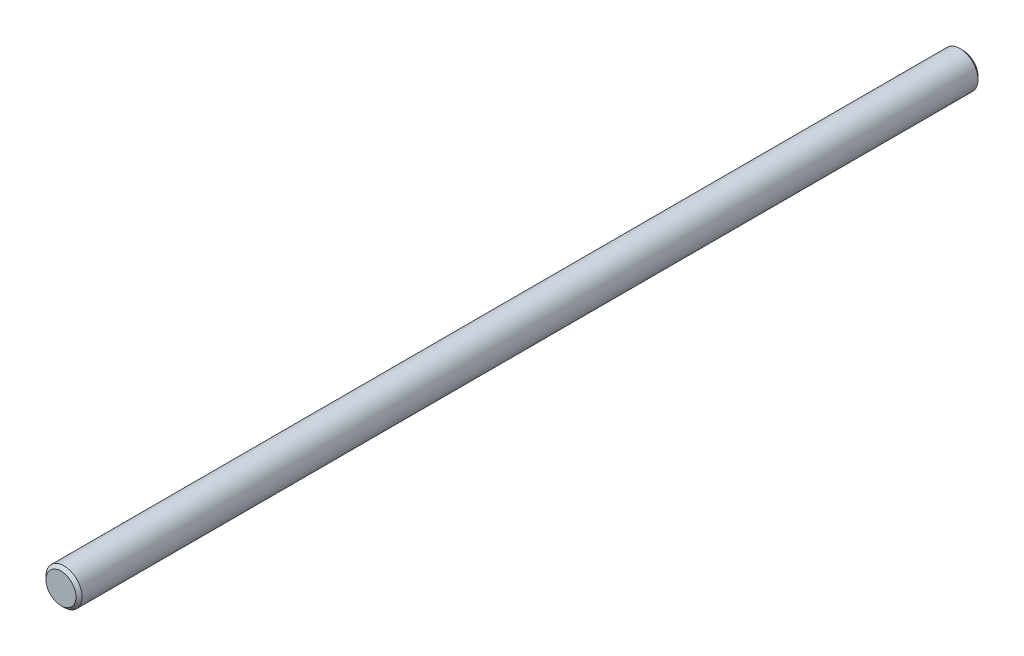
from build123d import *

# Parameters (mm, degrees)
SKETCH1_R           = 6
BOSS_EXTRUDE1_DEPTH = 150
CHAMFER1_SIZE       = 1


with BuildPart() as part:
    # Sketch1 → Boss-Extrude1 (new, symmetric)
    with BuildSketch(Plane.XY):
        Circle(SKETCH1_R)
    extrude(amount=BOSS_EXTRUDE1_DEPTH, both=True)

    # Chamfer1
    chamfer1_edges = [part.edges().sort_by_distance(p)[0] for p in [
        (-6, 0, -150),
        (-6, 0, 150),
    ]]
    chamfer(chamfer1_edges, length=CHAMFER1_SIZE)


solid = part.part
